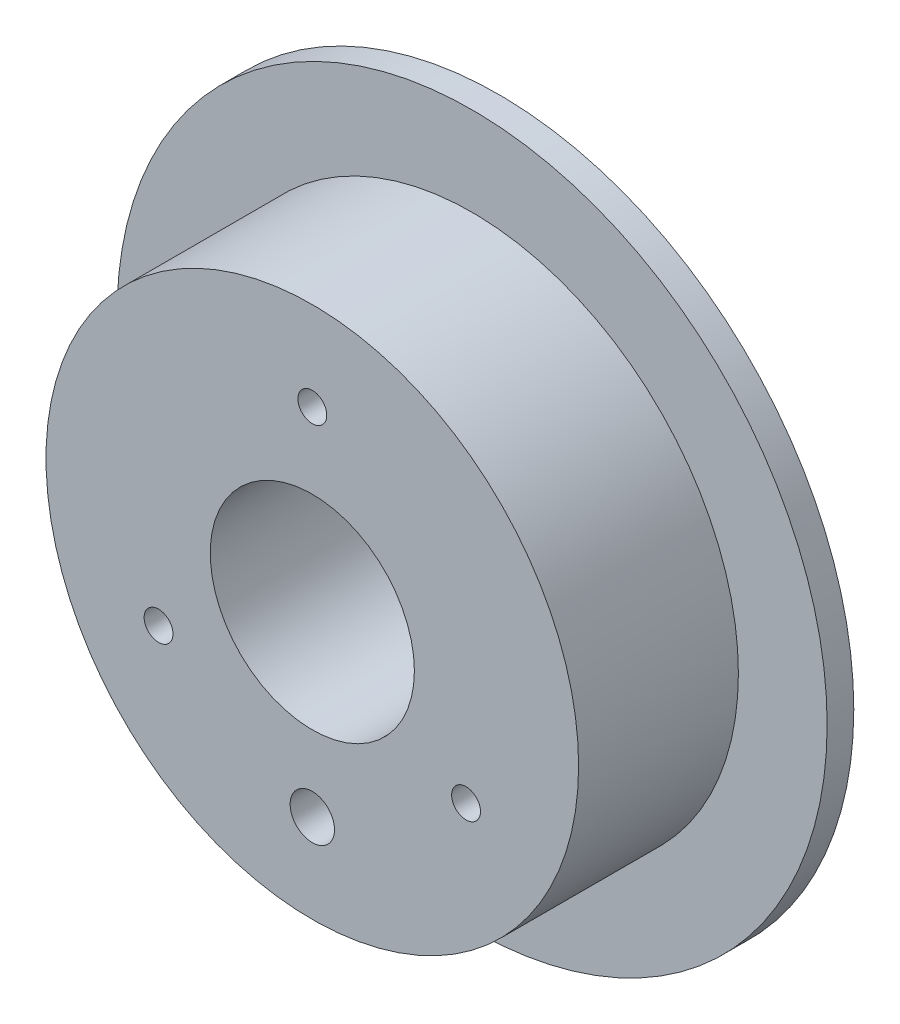
from build123d import *

# Parameters (mm, degrees)
SKETCH1_R           = 40
BOSS_EXTRUDE1_DEPTH = 3
SKETCH2_R           = 30
BOSS_EXTRUDE2_DEPTH = 18
SKETCH3_R           = 1.625
SKETCH3_R_2         = 11.5
SKETCH3_R_3         = 2.5
CUT_EXTRUDE1_DEPTH  = 61.340699366


with BuildPart() as part:
    # Sketch1 → Boss-Extrude1 (new body)
    with BuildSketch(Plane.XY):
        Circle(SKETCH1_R)
    extrude(amount=BOSS_EXTRUDE1_DEPTH)

    # Sketch2 → Boss-Extrude2 (add)
    with BuildSketch(Plane.XY.offset(3)):
        Circle(SKETCH2_R)
    extrude(amount=BOSS_EXTRUDE2_DEPTH)

    # Sketch3 → Cut-Extrude1 (cut, through all)
    with BuildSketch(Plane.XY.offset(21)):
        with Locations((0, 20)):
            Circle(SKETCH3_R)
        with Locations((17.320508076, -10)):
            Circle(SKETCH3_R)
        with Locations((-17.320508076, -10)):
            Circle(SKETCH3_R)
        Circle(SKETCH3_R_2)
        with Locations((0, -20)):
            Circle(SKETCH3_R_3)
    extrude(amount=-CUT_EXTRUDE1_DEPTH, mode=Mode.SUBTRACT)


solid = part.part
